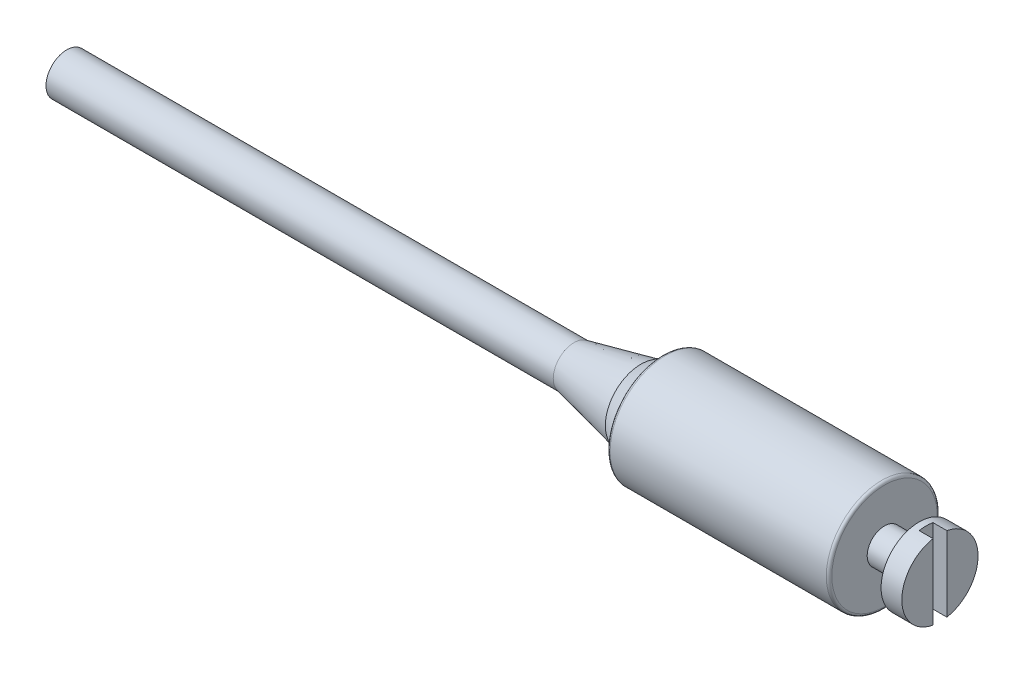
from build123d import *

# Parameters (mm, degrees)
FILLET1_R          = 0.2
SKETCH2_W          = 1
SKETCH2_H          = 6.101946446
CUT_EXTRUDE1_DEPTH = 1


with BuildPart() as part:
    # Sketch1 → Revolve1 (revolve)
    with BuildSketch(Plane.XY, mode=Mode.PRIVATE) as revolve1_sk:
        Polygon((-6.402554748, 1.5), (-43, 1.5), (-43, 0), (16, 0), (20, 0), (20, 2.75), (18.5, 2.75), (18.5, 1.25), (16, 1.25), (16, 4), (0, 4), (0, 3.603313767), (-1.581765583, 2.560980975), align=None)
    revolve(revolve1_sk.sketch.rotate(Axis((-43, 0, 0), (1, 0, 0)), 90), axis=Axis((-43, 0, 0), (1, 0, 0)))

    # Fillet1
    fillet1_edges = [part.edges().sort_by_distance(p)[0] for p in [
        (0, 0, -4),
        (16, 0, -4),
    ]]
    fillet(fillet1_edges, radius=FILLET1_R)

    # Sketch2 → Cut-Extrude1 (cut)
    with BuildSketch(Plane(origin=(20, 0, 0), x_dir=(0, 0, -1), z_dir=(1, 0, 0))):
        with Locations((0, 0.058366444)):
            Rectangle(SKETCH2_W, SKETCH2_H)
    extrude(amount=-CUT_EXTRUDE1_DEPTH, mode=Mode.SUBTRACT)


solid = part.part
